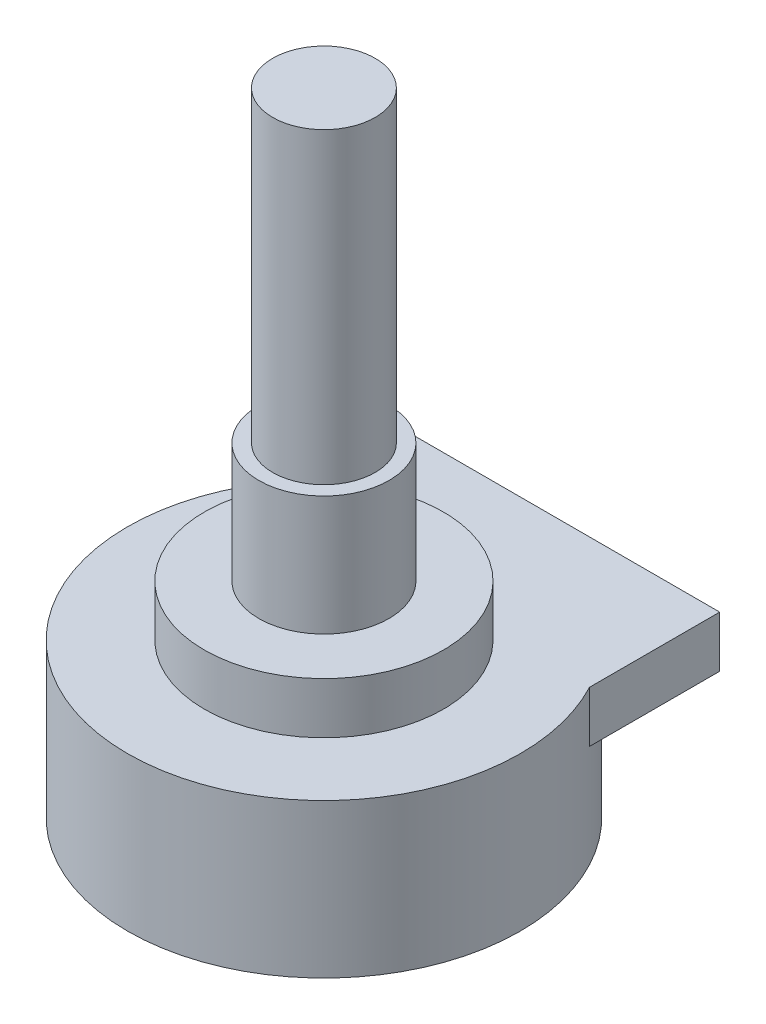
from build123d import *

# Parameters (mm, degrees)
SKETCH1_R           = 7
BOSS_EXTRUDE1_DEPTH = 9
SKETCH1_3_R         = 7
SKETCH1_3_R_2       = 3.81
BOSS_EXTRUDE2_DEPTH = 12
SKETCH1_4_R         = 3.81
SKETCH1_4_R_2       = 3
BOSS_EXTRUDE3_DEPTH = 19
SKETCH1_5_R         = 3
BOSS_EXTRUDE4_DEPTH = 37
CUT_EXTRUDE1_DEPTH  = 6


with BuildPart() as part:
    # Sketch1 → Boss-Extrude1 (new body)
    with BuildSketch(Plane(origin=(0, 0, 0), x_dir=(1, 0, 0), z_dir=(0, 1, 0))):
        with BuildLine():
            Line((11.2776, 8.7884), (-9.0424, 8.7884))
            Line((-9.0424, 8.7884), (-9.0424, 1.1684))
            ThreePointArc((-9.0424, 1.1684), (1.1176, -15.719029814), (11.2776, 1.1684))
            Line((11.2776, 1.1684), (11.2776, 8.7884))
        make_face()
        with Locations((1.1176, -4.219029814)):
            Circle(SKETCH1_R, mode=Mode.SUBTRACT)
    extrude(amount=BOSS_EXTRUDE1_DEPTH)

    # Sketch1<3> → Boss-Extrude2 (add)
    with BuildSketch(Plane(origin=(0, 0, 0), x_dir=(1, 0, 0), z_dir=(0, 1, 0))):
        with Locations((1.1176, -4.219029814)):
            Circle(SKETCH1_3_R)
        with Locations((1.1176, -4.219029814)):
            Circle(SKETCH1_3_R_2, mode=Mode.SUBTRACT)
    extrude(amount=BOSS_EXTRUDE2_DEPTH)

    # Sketch1<4> → Boss-Extrude3 (add)
    with BuildSketch(Plane(origin=(0, 0, 0), x_dir=(1, 0, 0), z_dir=(0, 1, 0))):
        with Locations((1.1176, -4.219029814)):
            Circle(SKETCH1_4_R)
        with Locations((1.1176, -4.219029814)):
            Circle(SKETCH1_4_R_2, mode=Mode.SUBTRACT)
    extrude(amount=BOSS_EXTRUDE3_DEPTH)

    # Sketch1<5> → Boss-Extrude4 (add)
    with BuildSketch(Plane(origin=(0, 0, 0), x_dir=(1, 0, 0), z_dir=(0, 1, 0))):
        with Locations((1.1176, -4.219029814)):
            Circle(SKETCH1_5_R)
    extrude(amount=BOSS_EXTRUDE4_DEPTH)

    # Sketch2 → Cut-Extrude1 (cut)
    with BuildSketch(Plane(origin=(0, 0, 0), x_dir=(-1, 0, 0), z_dir=(0, -1, 0))):
        with BuildLine():
            Line((9.0424, 1.1684), (9.0424, 8.7884))
            Line((9.0424, 8.7884), (-11.2776, 8.7884))
            Line((-11.2776, 8.7884), (-11.2776, 1.1684))
            ThreePointArc((-11.2776, 1.1684), (-1.1176, 7.280970186), (9.0424, 1.1684))
        make_face()
    extrude(amount=-CUT_EXTRUDE1_DEPTH, mode=Mode.SUBTRACT)


solid = part.part
